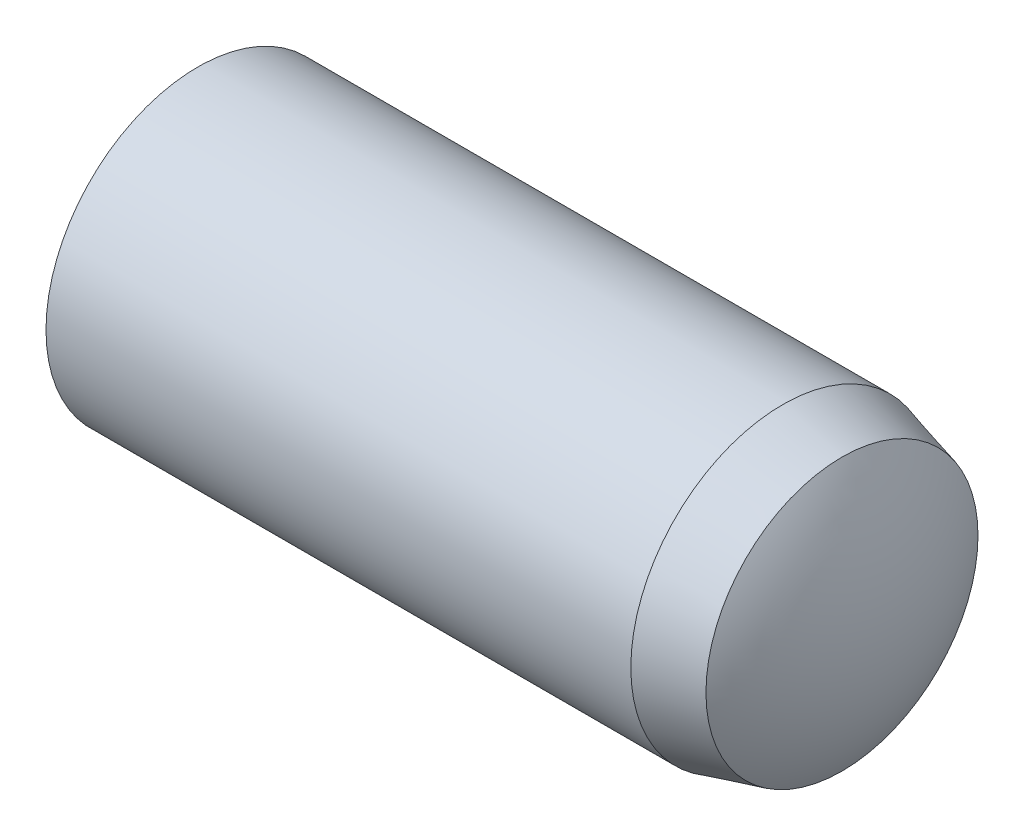
from build123d import *

# Parameters (mm, degrees)
EXTRUDE1_DEPTH      = 6
EXTRUDE1_DEPTH_BACK = 6
SKETCH2_R           = 2.5


with BuildPart() as part:
    # Sketch2 → Extrude1 (new, two sides: drawn at the far end of the back side and taken through both)
    with BuildSketch(Plane(origin=(0, 0, 0), x_dir=(0, 0, -1), z_dir=(1, 0, 0)).offset(-EXTRUDE1_DEPTH_BACK)):
        Circle(SKETCH2_R)
    extrude(amount=EXTRUDE1_DEPTH + EXTRUDE1_DEPTH_BACK)

    # Sketch5 → Cut-Revolve1 (revolve, cut)
    with BuildSketch(Plane.XY, mode=Mode.PRIVATE) as cut_revolve1_sk:
        with BuildLine():
            Line((4.375, 2.5), (4.375, 3))
            Line((4.375, 3), (6.5, 3))
            Line((6.5, 3), (6.5, 0))
            Line((6.5, 0), (6, 0))
            ThreePointArc((6, 0), (5.834212566, 1.165600649), (5.35, 2.238749537))
            Line((5.35, 2.238749537), (4.375, 2.5))
        make_face()
        with BuildLine():
            Line((-5.25, 2.5), (-5.25, 3))
            Line((-5.25, 3), (-6.5, 3))
            Line((-6.5, 3), (-6.5, 0))
            Line((-6.5, 0), (-6, 0))
            ThreePointArc((-6, 0), (-5.808461045, 1.305038314), (-5.25, 2.5))
        make_face()
    revolve(cut_revolve1_sk.sketch.rotate(Axis((-6, 0, 0), (1, 0, 0)), 90), axis=Axis((-6, 0, 0), (1, 0, 0)), mode=Mode.SUBTRACT)


solid = part.part
